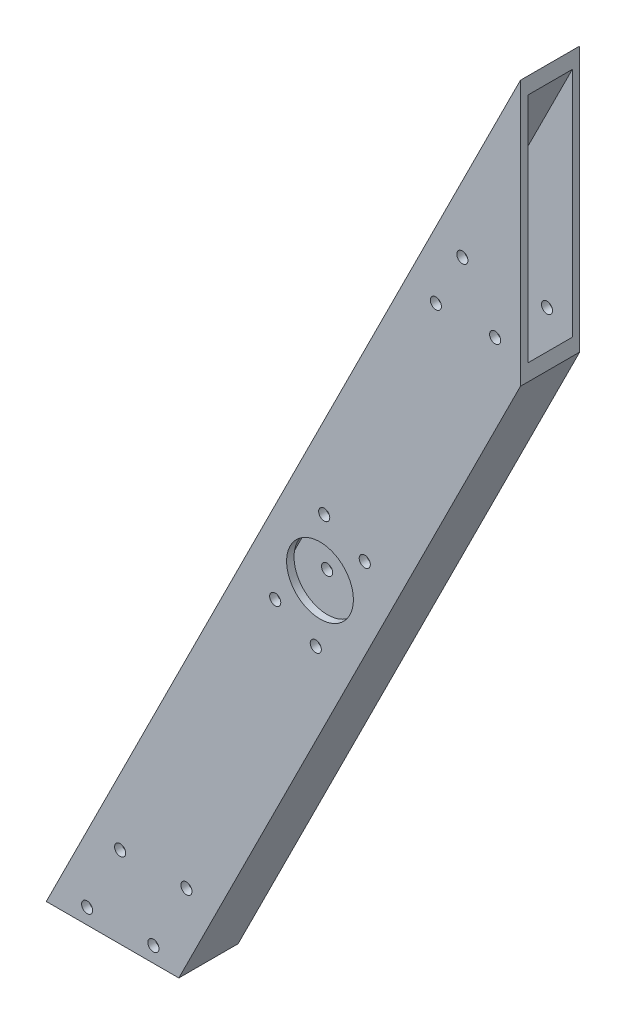
from build123d import *

# Parameters (mm, degrees)
BOSS_EXTRUDE1_DEPTH = 25.4
SHELL1_T            = -3.175
SKETCH2_R           = 14.3129
CUT_EXTRUDE1_DEPTH  = 456.078410826
SKETCH3_R           = 2.38125
CUT_EXTRUDE2_DEPTH  = 456.078410826
SKETCH4_R           = 2.38125
CUT_EXTRUDE3_DEPTH  = 456.078410826


with BuildPart() as part:
    # Sketch1 → Boss-Extrude1 (new body)
    with BuildSketch(Plane.XY):
        Polygon((0, 0), (203.2, 406.4), (203.2, 292.807746743), (56.796126628, 0), align=None)
    extrude(amount=BOSS_EXTRUDE1_DEPTH)

    # Shell1
    shell1_openings = [part.faces().sort_by_distance(p)[0] for p in [
        (203.2, 349.603873372, 12.7),
        (28.398063314, 0, 12.7),
    ]]
    offset(amount=SHELL1_T, openings=shell1_openings, kind=Kind.INTERSECTION)

    # Sketch2 → Cut-Extrude1 (cut, through all)
    with BuildSketch(Plane.XY.offset(25.4)):
        with Locations((117.298063314, 177.8)):
            Circle(SKETCH2_R)
    extrude(amount=-CUT_EXTRUDE1_DEPTH, mode=Mode.SUBTRACT)

    # Sketch3 → Cut-Extrude2 (cut, through all)
    with BuildSketch(Plane.XY.offset(25.4)):
        with Locations((119.098644425, 203.136098904)):
            Circle(SKETCH3_R)
        with Locations((136.486593771, 194.442124231)):
            Circle(SKETCH3_R)
        with Locations((98.109532857, 161.157875769)):
            Circle(SKETCH3_R)
        with Locations((115.497482204, 152.463901096)):
            Circle(SKETCH3_R)
    extrude(amount=-CUT_EXTRUDE2_DEPTH, mode=Mode.SUBTRACT)

    # Sketch4 → Cut-Extrude3 (cut, through all)
    with BuildSketch(Plane.XY.offset(25.4)):
        with Locations((17.501031657, 6.604)):
            Circle(SKETCH4_R)
        with Locations((45.899094971, 6.604)):
            Circle(SKETCH4_R)
        with Locations((31.661531657, 34.925)):
            Circle(SKETCH4_R)
        with Locations((60.059594971, 34.925)):
            Circle(SKETCH4_R)
        with Locations((166.949905286, 305.501747258)):
            Circle(SKETCH4_R)
        with Locations((178.309130612, 328.22019791)):
            Circle(SKETCH4_R)
        with Locations((192.349905286, 305.501747258)):
            Circle(SKETCH4_R)
    extrude(amount=-CUT_EXTRUDE3_DEPTH, mode=Mode.SUBTRACT)


solid = part.part
